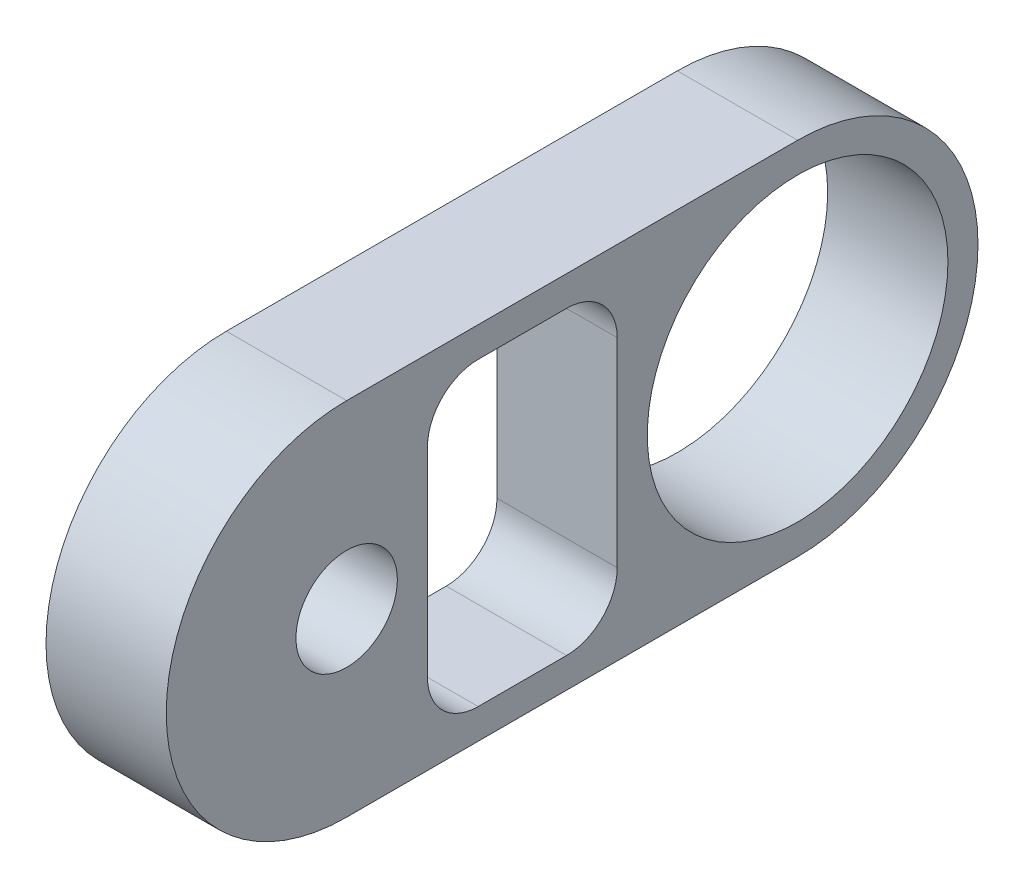
from build123d import *

# Parameters (mm, degrees)
SKETCH1_R           = 12.7
SKETCH1_R_2         = 4.28498
BOSS_EXTRUDE1_DEPTH = 10.159999949
SKETCH2_W           = 25.4
SKETCH2_H           = 16.03502
CUT_EXTRUDE1_DEPTH  = 73.464875935
FILLET1_R           = 4.28498


with BuildPart() as part:
    # Sketch1 → Boss-Extrude1 (new body)
    with BuildSketch(Plane.YZ):
        with BuildLine():
            Line((-60.873619371, 15.361912765), (-60.873619371, -22.738087235))
            ThreePointArc((-60.873619371, -22.738087235), (-45.633619371, -37.978087235), (-30.393619371, -22.738087235))
            Line((-30.393619371, -22.738087235), (-30.393619371, 15.361912765))
            ThreePointArc((-30.393619371, 15.361912765), (-45.633619371, 30.601912765), (-60.873619371, 15.361912765))
        make_face()
        with Locations(Location((-45.633619371, -22.738087235, 0), (0, 0, 270))):
            Circle(SKETCH1_R, mode=Mode.SUBTRACT)
        with Locations(Location((-45.633619371, 15.361912765, 0), (0, 0, 270))):
            Circle(SKETCH1_R_2, mode=Mode.SUBTRACT)
    extrude(amount=BOSS_EXTRUDE1_DEPTH)

    # Sketch2 → Cut-Extrude1 (cut, through all)
    with BuildSketch(Plane.YZ.offset(10.159999949)):
        with Locations((-45.633619371, 0.519422765)):
            Rectangle(SKETCH2_W, SKETCH2_H)
    extrude(amount=-CUT_EXTRUDE1_DEPTH, mode=Mode.SUBTRACT)

    # Fillet1
    fillet1_edges = [part.edges().sort_by_distance(p)[0] for p in [
        (5.079999975, -58.333619371, -7.498087235),
        (5.079999975, -58.333619371, 8.536932765),
        (5.079999975, -32.933619371, 8.536932765),
        (5.079999975, -32.933619371, -7.498087235),
    ]]
    fillet(fillet1_edges, radius=FILLET1_R)


solid = part.part
